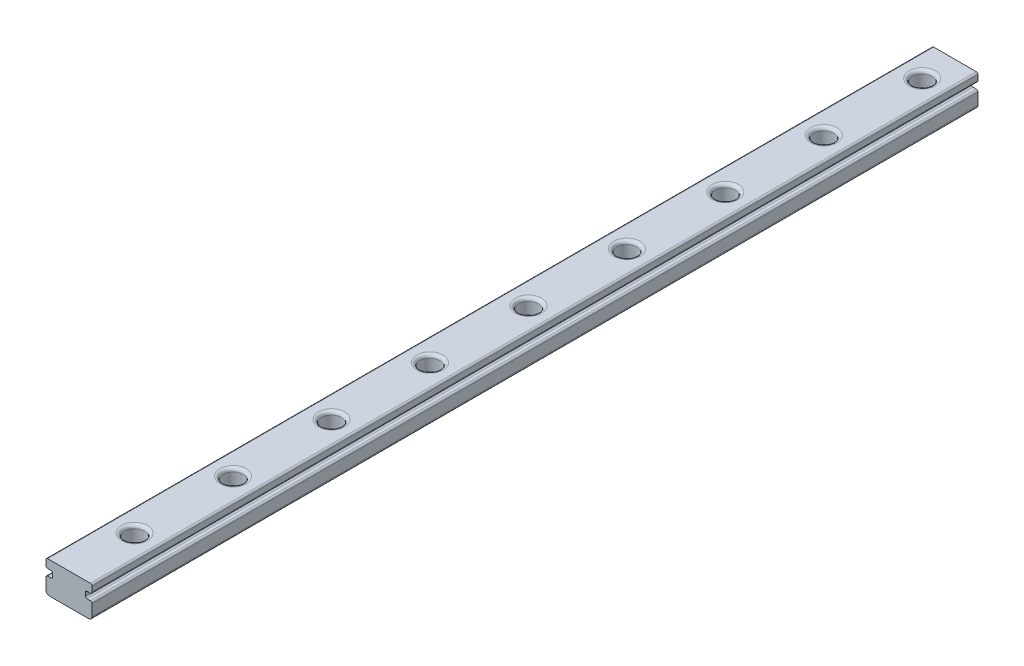
from build123d import *

# Parameters (mm, degrees)
EXTRUDE_1_DEPTH                = 135
FILLET_1_R                     = 0.25
FILLET_2_R                     = 0.5
SKETCH_2_R                     = 1.5
CUT_EXTRUDE_1_DEPTH            = 2.3
SKETCH_3_R                     = 1.2
CUT_EXTRUDE_2_DEPTH            = 136.204474778
FILLET_3_R                     = 0.5
PATTERN_LINEAR_2_COUNT         = 9
PATTERN_LINEAR_2_PITCH         = 15
FILLET_3_OF_PATTERN_LINEAR_2_R = 0.5


with BuildPart() as part:
    # 草图1 → 凸台-拉伸1 (new body)
    with BuildSketch(Plane.XY):
        Polygon((7, 2.5), (7, 0), (0, 0), (0, 2.5), (1, 2.5), (1, 3.5), (0, 3.5), (0, 4.8), (7, 4.8), (7, 3.5), (6, 3.5), (6, 2.5), align=None)
    extrude(amount=EXTRUDE_1_DEPTH)

    # 圆角1
    fillet_1_edges = [part.edges().sort_by_distance(p)[0] for p in [
        (0, 2.5, 67.5),
        (1, 2.5, 67.5),
        (1, 3.5, 67.5),
        (0, 3.5, 67.5),
        (0, 4.8, 67.5),
        (7, 4.8, 67.5),
        (7, 3.5, 67.5),
        (6, 3.5, 67.5),
        (6, 2.5, 67.5),
        (7, 2.5, 67.5),
    ]]
    fillet(fillet_1_edges, radius=FILLET_1_R)

    # 圆角2
    fillet_2_edges = [part.edges().sort_by_distance(p)[0] for p in [
        (7, 0, 67.5),
        (0, 0, 67.5),
    ]]
    fillet(fillet_2_edges, radius=FILLET_2_R)

    # 草图2 → 切除-拉伸1 (cut)
    with BuildSketch(Plane(origin=(0, 4.8, 0), x_dir=(1, 0, 0), z_dir=(0, 1, 0))):
        with Locations(Location((3.5, -5, 0), (0, 0, 270))):
            Circle(SKETCH_2_R)
    cut_extrude_1 = extrude(amount=-CUT_EXTRUDE_1_DEPTH, mode=Mode.SUBTRACT)

    # 草图3 → 切除-拉伸2 (cut, through all)
    with BuildSketch(Plane(origin=(0, 2.5, 0), x_dir=(1, 0, 0), z_dir=(0, 1, 0))):
        with Locations(Location((3.5, -5, 0), (0, 0, 270))):
            Circle(SKETCH_3_R)
    cut_extrude_2 = extrude(amount=-CUT_EXTRUDE_2_DEPTH, mode=Mode.SUBTRACT)

    # 圆角3
    fillet_3_edges = [part.edges().sort_by_distance(p)[0] for p in [
        (3.5, 4.8, 3.5),
    ]]
    fillet(fillet_3_edges, radius=FILLET_3_R)

    # 阵列(线性)2: 切除-拉伸1, 切除-拉伸2 ×9
    with Locations(*[(0, 0, i * PATTERN_LINEAR_2_PITCH) for i in range(1, PATTERN_LINEAR_2_COUNT)]):
        add(cut_extrude_1, mode=Mode.SUBTRACT)
        add(cut_extrude_2, mode=Mode.SUBTRACT)

    # 圆角3 of 阵列(线性)2
    fillet_3_of_pattern_linear_2_edges = [part.edges().sort_by_distance(p)[0] for p in [
        (3.5, 4.8, 18.5),
        (3.5, 4.8, 33.5),
        (3.5, 4.8, 48.5),
        (3.5, 4.8, 63.5),
        (3.5, 4.8, 78.5),
        (3.5, 4.8, 93.5),
        (3.5, 4.8, 108.5),
        (3.5, 4.8, 123.5),
    ]]
    fillet(fillet_3_of_pattern_linear_2_edges, radius=FILLET_3_OF_PATTERN_LINEAR_2_R)


solid = part.part
